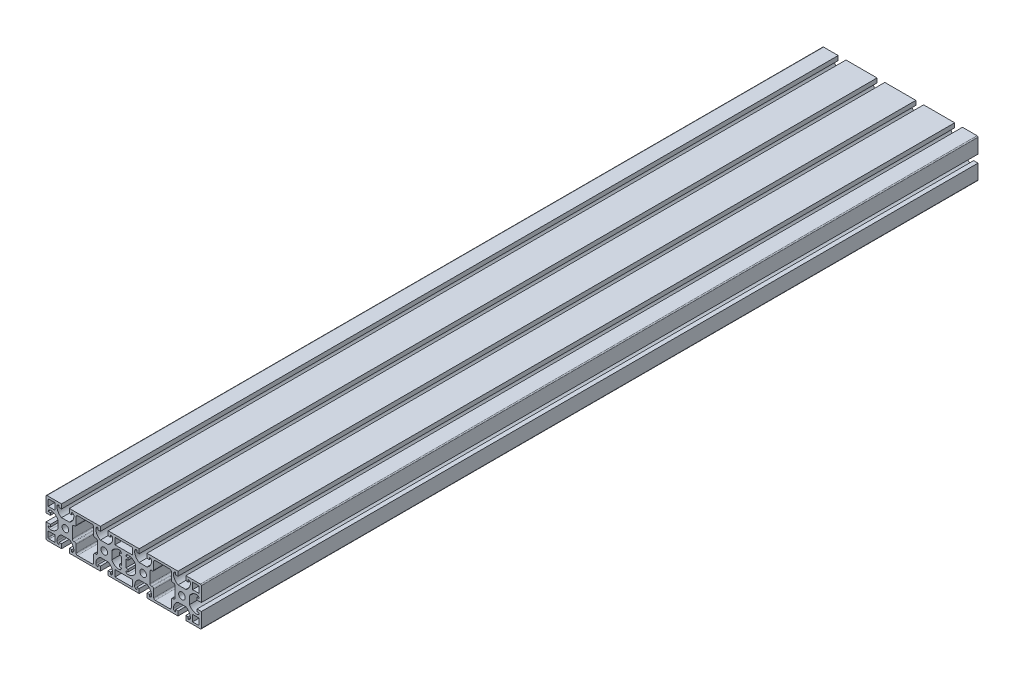
from build123d import *

# Parameters (mm, degrees)
SZKIC1_W                    = 18.057236458
SZKIC1_H                    = 6.778618229
SZKIC1_R                    = 3.4
DODANIE_WYCI_GNI_CIE1_DEPTH = 800


with BuildPart() as part:
    # Szkic1 → Dodanie-wyciągnięcie1 (new body)
    with BuildSketch(Plane.XY):
        with BuildLine():
            Line((-56, -20), (-24, -20))
            Line((-24, -20), (-24, -15.5))
            Line((-24, -15.5), (-26.471381771, -15.5))
            Line((-26.471381771, -15.5), (-26.471381771, -17.75))
            ThreePointArc((-26.471381771, -17.75), (-28.062372029, -17.090990258), (-28.721381771, -15.5))
            ThreePointArc((-28.721381771, -15.5), (-27.448087912, -10.962546258), (-24, -7.75))
            Line((-24, -7.75), (-16, -7.75))
            ThreePointArc((-16, -7.75), (-12.551912088, -10.962546258), (-11.278618229, -15.5))
            ThreePointArc((-11.278618229, -15.5), (-11.937627971, -17.090990258), (-13.528618229, -17.75))
            Line((-13.528618229, -17.75), (-13.528618229, -15.5))
            Line((-13.528618229, -15.5), (-16, -15.5))
            Line((-16, -15.5), (-16, -20))
            Line((-16, -20), (16, -20))
            Line((16, -20), (16, -15.5))
            Line((16, -15.5), (13.528618229, -15.5))
            Line((13.528618229, -15.5), (13.528618229, -17.75))
            ThreePointArc((13.528618229, -17.75), (11.937627971, -17.090990258), (11.278618229, -15.5))
            ThreePointArc((11.278618229, -15.5), (12.551912088, -10.962546258), (16, -7.75))
            Line((16, -7.75), (24, -7.75))
            ThreePointArc((24, -7.75), (27.448087912, -10.962546258), (28.721381771, -15.5))
            ThreePointArc((28.721381771, -15.5), (28.062372029, -17.090990258), (26.471381771, -17.75))
            Line((26.471381771, -17.75), (26.471381771, -15.5))
            Line((26.471381771, -15.5), (24, -15.5))
            Line((24, -15.5), (24, -20))
            Line((24, -20), (39, -20))
            ThreePointArc((39, -20), (39.707106781, -19.707106781), (40, -19))
            Line((40, -19), (40, -4))
            Line((40, -4), (35.5, -4))
            Line((35.5, -4), (35.5, -6.471381771))
            Line((35.5, -6.471381771), (37.75, -6.471381771))
            ThreePointArc((37.75, -6.471381771), (37.090990258, -8.062372029), (35.5, -8.721381771))
            ThreePointArc((35.5, -8.721381771), (30.962546258, -7.448087912), (27.75, -4))
            Line((27.75, -4), (27.75, 4))
            ThreePointArc((27.75, 4), (30.962546258, 7.448087912), (35.5, 8.721381771))
            ThreePointArc((35.5, 8.721381771), (37.090990258, 8.062372029), (37.75, 6.471381771))
            Line((37.75, 6.471381771), (35.5, 6.471381771))
            Line((35.5, 6.471381771), (35.5, 4))
            Line((35.5, 4), (40, 4))
            Line((40, 4), (40, 19))
            ThreePointArc((40, 19), (39.707106781, 19.707106781), (39, 20))
            Line((39, 20), (24, 20))
            Line((24, 20), (24, 15.5))
            Line((24, 15.5), (26.471381771, 15.5))
            Line((26.471381771, 15.5), (26.471381771, 17.75))
            ThreePointArc((26.471381771, 17.75), (28.062372029, 17.090990258), (28.721381771, 15.5))
            ThreePointArc((28.721381771, 15.5), (27.448087912, 10.962546258), (24, 7.75))
            Line((24, 7.75), (16, 7.75))
            ThreePointArc((16, 7.75), (12.551912088, 10.962546258), (11.278618229, 15.5))
            ThreePointArc((11.278618229, 15.5), (11.937627971, 17.090990258), (13.528618229, 17.75))
            Line((13.528618229, 17.75), (13.528618229, 15.5))
            Line((13.528618229, 15.5), (16, 15.5))
            Line((16, 15.5), (16, 20))
            Line((16, 20), (-16, 20))
            Line((-16, 20), (-16, 15.5))
            Line((-16, 15.5), (-13.528618229, 15.5))
            Line((-13.528618229, 15.5), (-13.528618229, 17.75))
            ThreePointArc((-13.528618229, 17.75), (-11.937627971, 17.090990258), (-11.278618229, 15.5))
            ThreePointArc((-11.278618229, 15.5), (-12.551912088, 10.962546258), (-16, 7.75))
            Line((-16, 7.75), (-24, 7.75))
            ThreePointArc((-24, 7.75), (-27.448087912, 10.962546258), (-28.721381771, 15.5))
            ThreePointArc((-28.721381771, 15.5), (-28.062372029, 17.090990258), (-26.471381771, 17.75))
            Line((-26.471381771, 17.75), (-26.471381771, 15.5))
            Line((-26.471381771, 15.5), (-24, 15.5))
            Line((-24, 15.5), (-24, 20))
            Line((-24, 20), (-56, 20))
            Line((-56, 20), (-56, 15.5))
            Line((-56, 15.5), (-53.528618229, 15.5))
            Line((-53.528618229, 15.5), (-53.528618229, 17.75))
            ThreePointArc((-53.528618229, 17.75), (-51.937627971, 17.090990258), (-51.278618229, 15.5))
            ThreePointArc((-51.278618229, 15.5), (-52.551912088, 10.962546258), (-56, 7.75))
            Line((-56, 7.75), (-64, 7.75))
            ThreePointArc((-64, 7.75), (-67.448087912, 10.962546258), (-68.721381771, 15.5))
            ThreePointArc((-68.721381771, 15.5), (-68.062372029, 17.090990258), (-66.471381771, 17.75))
            Line((-66.471381771, 17.75), (-66.471381771, 15.5))
            Line((-66.471381771, 15.5), (-64, 15.5))
            Line((-64, 15.5), (-64, 20))
            Line((-64, 20), (-96, 20))
            Line((-96, 20), (-96, 15.5))
            Line((-96, 15.5), (-93.528618229, 15.5))
            Line((-93.528618229, 15.5), (-93.528618229, 17.75))
            ThreePointArc((-93.528618229, 17.75), (-91.937627971, 17.090990258), (-91.278618229, 15.5))
            ThreePointArc((-91.278618229, 15.5), (-92.551912088, 10.962546258), (-96, 7.75))
            Line((-96, 7.75), (-104, 7.75))
            ThreePointArc((-104, 7.75), (-107.448087912, 10.962546258), (-108.721381771, 15.5))
            ThreePointArc((-108.721381771, 15.5), (-108.062372029, 17.090990258), (-106.471381771, 17.75))
            Line((-106.471381771, 17.75), (-106.471381771, 15.5))
            Line((-106.471381771, 15.5), (-104, 15.5))
            Line((-104, 15.5), (-104, 20))
            Line((-104, 20), (-119, 20))
            ThreePointArc((-119, 20), (-119.707106781, 19.707106781), (-120, 19))
            Line((-120, 19), (-120, 4))
            Line((-120, 4), (-115.5, 4))
            Line((-115.5, 4), (-115.5, 6.471381771))
            Line((-115.5, 6.471381771), (-117.75, 6.471381771))
            ThreePointArc((-117.75, 6.471381771), (-117.090990258, 8.062372029), (-115.5, 8.721381771))
            ThreePointArc((-115.5, 8.721381771), (-110.962546258, 7.448087912), (-107.75, 4))
            Line((-107.75, 4), (-107.75, -4))
            ThreePointArc((-107.75, -4), (-110.962546258, -7.448087912), (-115.5, -8.721381771))
            ThreePointArc((-115.5, -8.721381771), (-117.090990258, -8.062372029), (-117.75, -6.471381771))
            Line((-117.75, -6.471381771), (-115.5, -6.471381771))
            Line((-115.5, -6.471381771), (-115.5, -4))
            Line((-115.5, -4), (-120, -4))
            Line((-120, -4), (-120, -19))
            ThreePointArc((-120, -19), (-119.707106781, -19.707106781), (-119, -20))
            Line((-119, -20), (-104, -20))
            Line((-104, -20), (-104, -15.5))
            Line((-104, -15.5), (-106.471381771, -15.5))
            Line((-106.471381771, -15.5), (-106.471381771, -17.75))
            ThreePointArc((-106.471381771, -17.75), (-108.062372029, -17.090990258), (-108.721381771, -15.5))
            ThreePointArc((-108.721381771, -15.5), (-107.448087912, -10.962546258), (-104, -7.75))
            Line((-104, -7.75), (-96, -7.75))
            ThreePointArc((-96, -7.75), (-92.551912088, -10.962546258), (-91.278618229, -15.5))
            ThreePointArc((-91.278618229, -15.5), (-91.937627971, -17.090990258), (-93.528618229, -17.75))
            Line((-93.528618229, -17.75), (-93.528618229, -15.5))
            Line((-93.528618229, -15.5), (-96, -15.5))
            Line((-96, -15.5), (-96, -20))
            Line((-96, -20), (-64, -20))
            Line((-64, -20), (-64, -15.5))
            Line((-64, -15.5), (-66.471381771, -15.5))
            Line((-66.471381771, -15.5), (-66.471381771, -17.75))
            ThreePointArc((-66.471381771, -17.75), (-68.062372029, -17.090990258), (-68.721381771, -15.5))
            ThreePointArc((-68.721381771, -15.5), (-67.448087912, -10.962546258), (-64, -7.75))
            Line((-64, -7.75), (-56, -7.75))
            ThreePointArc((-56, -7.75), (-52.551912088, -10.962546258), (-51.278618229, -15.5))
            ThreePointArc((-51.278618229, -15.5), (-51.937627971, -17.090990258), (-53.528618229, -17.75))
            Line((-53.528618229, -17.75), (-53.528618229, -15.5))
            Line((-53.528618229, -15.5), (-56, -15.5))
            Line((-56, -15.5), (-56, -20))
        make_face()
        with Locations((-40, 14.360690886)):
            Rectangle(SZKIC1_W, SZKIC1_H, mode=Mode.SUBTRACT)
        with Locations((-40, -14.360690886)):
            Rectangle(SZKIC1_W, SZKIC1_H, mode=Mode.SUBTRACT)
        with BuildLine():
            Line((-117.75, -10.971381771), (-110.971381771, -10.971381771))
            Line((-110.971381771, -10.971381771), (-110.971381771, -17.75))
            Line((-110.971381771, -17.75), (-116.75, -17.75))
            ThreePointArc((-116.75, -17.75), (-117.457106781, -17.457106781), (-117.75, -16.75))
            Line((-117.75, -16.75), (-117.75, -10.971381771))
        make_face(mode=Mode.SUBTRACT)
        with BuildLine():
            ThreePointArc((-89.028618229, -8.590188806), (-89.467958057, -7.529528634), (-90.528618229, -7.090188806))
            Line((-90.528618229, -7.090188806), (-91.40950808, -7.090188806))
            ThreePointArc((-91.40950808, -7.090188806), (-92.470168251, -6.650848977), (-92.90950808, -5.590188806))
            Line((-92.90950808, -5.590188806), (-92.90950808, 5.590188806))
            ThreePointArc((-92.90950808, 5.590188806), (-92.470168251, 6.650848977), (-91.40950808, 7.090188806))
            Line((-91.40950808, 7.090188806), (-90.528618229, 7.090188806))
            ThreePointArc((-90.528618229, 7.090188806), (-89.467958057, 7.529528634), (-89.028618229, 8.590188806))
            Line((-89.028618229, 8.590188806), (-89.028618229, 16.25))
            ThreePointArc((-89.028618229, 16.25), (-88.589278401, 17.310660172), (-87.528618229, 17.75))
            Line((-87.528618229, 17.75), (-72.471381771, 17.75))
            ThreePointArc((-72.471381771, 17.75), (-71.410721599, 17.310660172), (-70.971381771, 16.25))
            Line((-70.971381771, 16.25), (-70.971381771, 8.590188806))
            ThreePointArc((-70.971381771, 8.590188806), (-70.532041943, 7.529528634), (-69.471381771, 7.090188806))
            Line((-69.471381771, 7.090188806), (-68.59049192, 7.090188806))
            ThreePointArc((-68.59049192, 7.090188806), (-67.529831749, 6.650848977), (-67.09049192, 5.590188806))
            Line((-67.09049192, 5.590188806), (-67.09049192, -5.590188806))
            ThreePointArc((-67.09049192, -5.590188806), (-67.529831749, -6.650848977), (-68.59049192, -7.090188806))
            Line((-68.59049192, -7.090188806), (-69.471381771, -7.090188806))
            ThreePointArc((-69.471381771, -7.090188806), (-70.532041943, -7.529528634), (-70.971381771, -8.590188806))
            Line((-70.971381771, -8.590188806), (-70.971381771, -16.25))
            ThreePointArc((-70.971381771, -16.25), (-71.410721599, -17.310660172), (-72.471381771, -17.75))
            Line((-72.471381771, -17.75), (-87.528618229, -17.75))
            ThreePointArc((-87.528618229, -17.75), (-88.589278401, -17.310660172), (-89.028618229, -16.25))
            Line((-89.028618229, -16.25), (-89.028618229, -8.590188806))
        make_face(mode=Mode.SUBTRACT)
        with BuildLine():
            Line((-44.5, 4), (-42.25, 4))
            Line((-42.25, 4), (-42.25, -4))
            Line((-42.25, -4), (-44.5, -4))
            Line((-44.5, -4), (-44.5, -6.471381771))
            Line((-44.5, -6.471381771), (-42.25, -6.471381771))
            ThreePointArc((-42.25, -6.471381771), (-42.909009742, -8.062372029), (-44.5, -8.721381771))
            ThreePointArc((-44.5, -8.721381771), (-49.037453742, -7.448087912), (-52.25, -4))
            Line((-52.25, -4), (-52.25, 4))
            ThreePointArc((-52.25, 4), (-49.037453742, 7.448087912), (-44.5, 8.721381771))
            ThreePointArc((-44.5, 8.721381771), (-42.909009742, 8.062372029), (-42.25, 6.471381771))
            Line((-42.25, 6.471381771), (-44.5, 6.471381771))
            Line((-44.5, 6.471381771), (-44.5, 4))
        make_face(mode=Mode.SUBTRACT)
        with Locations((-100, 0)):
            Circle(SZKIC1_R, mode=Mode.SUBTRACT)
        with Locations((-60, 0)):
            Circle(SZKIC1_R, mode=Mode.SUBTRACT)
        with BuildLine():
            Line((-110.971381771, 10.971381771), (-117.75, 10.971381771))
            Line((-117.75, 10.971381771), (-117.75, 16.75))
            ThreePointArc((-117.75, 16.75), (-117.457106781, 17.457106781), (-116.75, 17.75))
            Line((-116.75, 17.75), (-110.971381771, 17.75))
            Line((-110.971381771, 17.75), (-110.971381771, 10.971381771))
        make_face(mode=Mode.SUBTRACT)
        with BuildLine():
            ThreePointArc((36.75, 17.75), (37.457106781, 17.457106781), (37.75, 16.75))
            Line((37.75, 16.75), (37.75, 10.971381771))
            Line((37.75, 10.971381771), (30.971381771, 10.971381771))
            Line((30.971381771, 10.971381771), (30.971381771, 17.75))
            Line((30.971381771, 17.75), (36.75, 17.75))
        make_face(mode=Mode.SUBTRACT)
        with BuildLine():
            Line((36.75, -17.75), (30.971381771, -17.75))
            Line((30.971381771, -17.75), (30.971381771, -10.971381771))
            Line((30.971381771, -10.971381771), (37.75, -10.971381771))
            Line((37.75, -10.971381771), (37.75, -16.75))
            ThreePointArc((37.75, -16.75), (37.457106781, -17.457106781), (36.75, -17.75))
        make_face(mode=Mode.SUBTRACT)
        with BuildLine():
            Line((-37.75, -6.471381771), (-35.5, -6.471381771))
            Line((-35.5, -6.471381771), (-35.5, -4))
            Line((-35.5, -4), (-37.75, -4))
            Line((-37.75, -4), (-37.75, 4))
            Line((-37.75, 4), (-35.5, 4))
            Line((-35.5, 4), (-35.5, 6.471381771))
            Line((-35.5, 6.471381771), (-37.75, 6.471381771))
            ThreePointArc((-37.75, 6.471381771), (-37.090990258, 8.062372029), (-35.5, 8.721381771))
            ThreePointArc((-35.5, 8.721381771), (-30.962546258, 7.448087912), (-27.75, 4))
            Line((-27.75, 4), (-27.75, -4))
            ThreePointArc((-27.75, -4), (-30.962546258, -7.448087912), (-35.5, -8.721381771))
            ThreePointArc((-35.5, -8.721381771), (-37.090990258, -8.062372029), (-37.75, -6.471381771))
        make_face(mode=Mode.SUBTRACT)
        with BuildLine():
            ThreePointArc((9.028618229, 8.590188806), (9.467958057, 7.529528634), (10.528618229, 7.090188806))
            Line((10.528618229, 7.090188806), (11.40950808, 7.090188806))
            ThreePointArc((11.40950808, 7.090188806), (12.470168251, 6.650848977), (12.90950808, 5.590188806))
            Line((12.90950808, 5.590188806), (12.90950808, -5.590188806))
            ThreePointArc((12.90950808, -5.590188806), (12.470168251, -6.650848977), (11.40950808, -7.090188806))
            Line((11.40950808, -7.090188806), (10.528618229, -7.090188806))
            ThreePointArc((10.528618229, -7.090188806), (9.467958057, -7.529528634), (9.028618229, -8.590188806))
            Line((9.028618229, -8.590188806), (9.028618229, -16.25))
            ThreePointArc((9.028618229, -16.25), (8.589278401, -17.310660172), (7.528618229, -17.75))
            Line((7.528618229, -17.75), (-7.528618229, -17.75))
            ThreePointArc((-7.528618229, -17.75), (-8.589278401, -17.310660172), (-9.028618229, -16.25))
            Line((-9.028618229, -16.25), (-9.028618229, -8.590188806))
            ThreePointArc((-9.028618229, -8.590188806), (-9.467958057, -7.529528634), (-10.528618229, -7.090188806))
            Line((-10.528618229, -7.090188806), (-11.40950808, -7.090188806))
            ThreePointArc((-11.40950808, -7.090188806), (-12.470168251, -6.650848977), (-12.90950808, -5.590188806))
            Line((-12.90950808, -5.590188806), (-12.90950808, 5.590188806))
            ThreePointArc((-12.90950808, 5.590188806), (-12.470168251, 6.650848977), (-11.40950808, 7.090188806))
            Line((-11.40950808, 7.090188806), (-10.528618229, 7.090188806))
            ThreePointArc((-10.528618229, 7.090188806), (-9.467958057, 7.529528634), (-9.028618229, 8.590188806))
            Line((-9.028618229, 8.590188806), (-9.028618229, 16.25))
            ThreePointArc((-9.028618229, 16.25), (-8.589278401, 17.310660172), (-7.528618229, 17.75))
            Line((-7.528618229, 17.75), (7.528618229, 17.75))
            ThreePointArc((7.528618229, 17.75), (8.589278401, 17.310660172), (9.028618229, 16.25))
            Line((9.028618229, 16.25), (9.028618229, 8.590188806))
        make_face(mode=Mode.SUBTRACT)
        with Locations((-20, 0)):
            Circle(SZKIC1_R, mode=Mode.SUBTRACT)
        with Locations((20, 0)):
            Circle(SZKIC1_R, mode=Mode.SUBTRACT)
    extrude(amount=DODANIE_WYCI_GNI_CIE1_DEPTH)


solid = part.part
